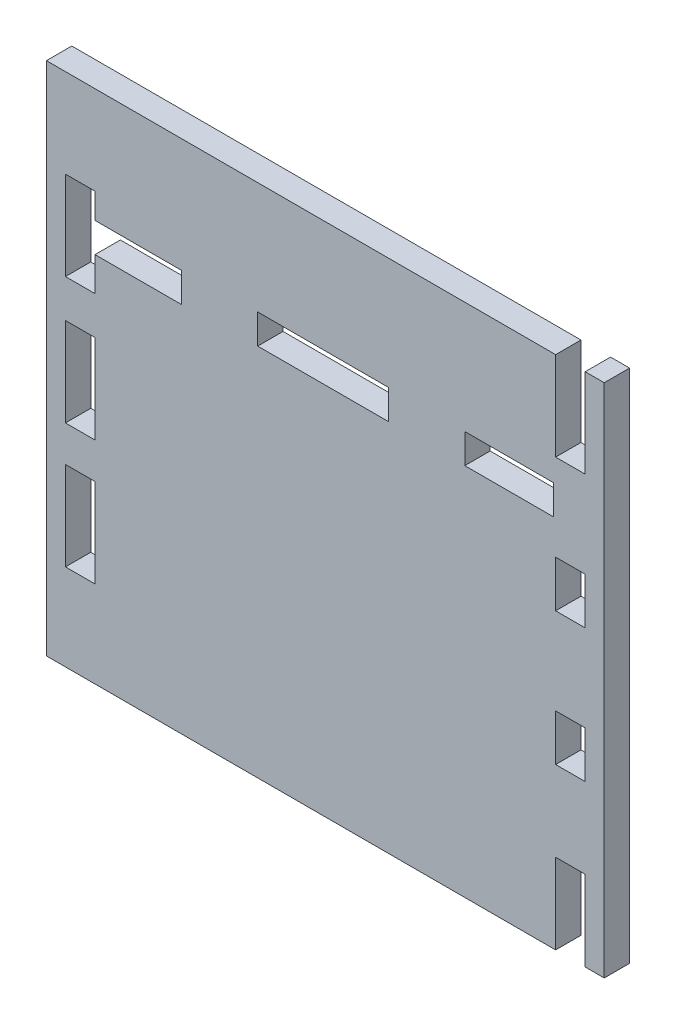
from build123d import *

# Parameters (mm, degrees)
SKETCH_1_W      = 15.5
SKETCH_1_H      = 3.5
SKETCH_1_W_2    = 10.5
SKETCH_1_W_3    = 3.5
SKETCH_1_H_2    = 5.5
SKETCH_1_H_3    = 10.5
EXTRUDE_1_DEPTH = 3


with BuildPart() as part:
    # Эскиз1 → Бобышка-Вытянуть1 (new body)
    with BuildSketch(Plane.XY):
        Polygon((30.75, -30.75), (33, -30.75), (33, 30.25), (30.75, 30.25), (30.75, 19.75), (27.25, 19.75), (27.25, 30.25), (-33, 30.25), (-33, -30.75), (27.25, -30.75), (27.25, -21.25), (30.75, -21.25), align=None)
        Polygon((-27.25, 13.25), (-27.25, 9.25), (-30.75, 9.25), (-30.75, 19.75), (-27.25, 19.75), (-27.25, 16.75), (-17, 16.75), (-17, 13.25), align=None, mode=Mode.SUBTRACT)
        with Locations((-0.25, 15.25)):
            Rectangle(SKETCH_1_W, SKETCH_1_H, mode=Mode.SUBTRACT)
        with Locations((21.75, 15.25)):
            Rectangle(SKETCH_1_W_2, SKETCH_1_H, mode=Mode.SUBTRACT)
        with Locations((29, 6.75)):
            Rectangle(SKETCH_1_W_3, SKETCH_1_H_2, mode=Mode.SUBTRACT)
        with Locations((29, -9)):
            Rectangle(SKETCH_1_W_3, SKETCH_1_H_2, mode=Mode.SUBTRACT)
        with Locations((-29, -0.5)):
            Rectangle(SKETCH_1_W_3, SKETCH_1_H_3, mode=Mode.SUBTRACT)
        with Locations((-29, -15.25)):
            Rectangle(SKETCH_1_W_3, SKETCH_1_H_3, mode=Mode.SUBTRACT)
    extrude(amount=EXTRUDE_1_DEPTH)


solid = part.part
